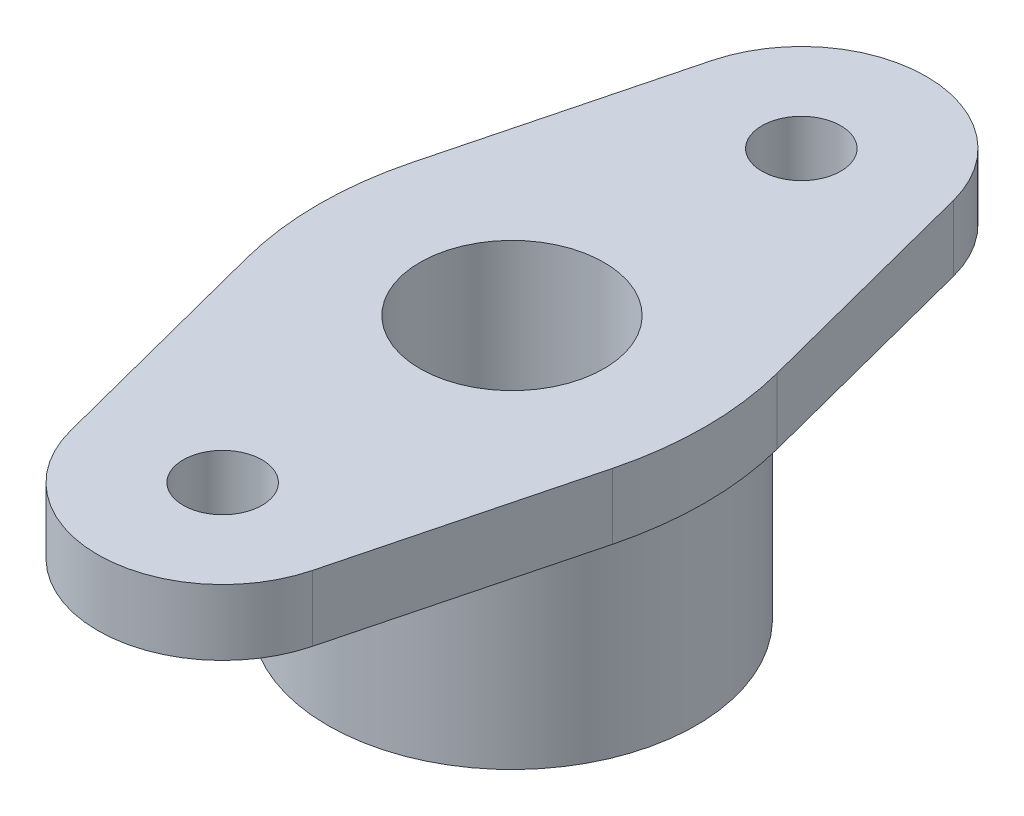
from build123d import *

# Parameters (mm, degrees)
SKETCH1_R           = 14
SKETCH1_R_2         = 19
SKETCH1_R_3         = 6
BOSS_EXTRUDE1_DEPTH = 10
FILLET1_R           = 50


with BuildPart() as part:
    # Sketch1 → Boss-Extrude1 (new body)
    # profile 1 of 3: a face of its own
    with BuildSketch(Plane(origin=(0, 0, 0), x_dir=(1, 0, 0), z_dir=(0, 1, 0))):
        with BuildLine():
            Line((-18.395196505, 48.755706629), (-31, 0))
            Line((-31, 0), (-18.395196505, -48.755706629))
            ThreePointArc((-18.395196505, -48.755706629), (-2.397005048, -25.151807333), (19, -44))
            ThreePointArc((19, -44), (18.848192667, -46.397005048), (18.395196505, -48.755706629))
            Line((18.395196505, -48.755706629), (31, 0))
            Line((31, 0), (18.395196505, 48.755706629))
            ThreePointArc((18.395196505, 48.755706629), (18.848192667, 46.397005048), (19, 44))
            ThreePointArc((19, 44), (-2.397005048, 25.151807333), (-18.395196505, 48.755706629))
        make_face()
        with Locations(Location((0, 0, 0), (0, 0, 270))):
            Circle(SKETCH1_R, mode=Mode.SUBTRACT)
    # profile 2 of 3: a face of its own
    with BuildSketch(Plane(origin=(0, 0, 0), x_dir=(1, 0, 0), z_dir=(0, 1, 0))):
        with Locations((0, -44)):
            Circle(SKETCH1_R_2)
        with Locations(Location((0, -44, 0), (0, 0, 270))):
            Circle(SKETCH1_R_3, mode=Mode.SUBTRACT)
    # profile 3 of 3: a face of its own
    with BuildSketch(Plane(origin=(0, 0, 0), x_dir=(1, 0, 0), z_dir=(0, 1, 0))):
        with Locations((0, 44)):
            Circle(SKETCH1_R_2)
        with Locations(Location((0, 44, 0), (0, 0, 270))):
            Circle(SKETCH1_R_3, mode=Mode.SUBTRACT)
    extrude(amount=BOSS_EXTRUDE1_DEPTH)

    # Fillet1
    fillet1_edges = [part.edges().sort_by_distance(p)[0] for p in [
        (-31, 5, 0),
        (31, 5, 0),
    ]]
    fillet(fillet1_edges, radius=FILLET1_R)

    # Sketch2 → Revolve1 (revolve)
    with BuildSketch(Plane.XY, mode=Mode.PRIVATE) as revolve1_sk:
        Polygon((14, 0), (28, 0), (28, -30), (14, -21.917096231), align=None)
    revolve(revolve1_sk.sketch.rotate(Axis((0, 0, 0), (0, -1, 0)), 90), axis=Axis((0, 0, 0), (0, -1, 0)))


solid = part.part
